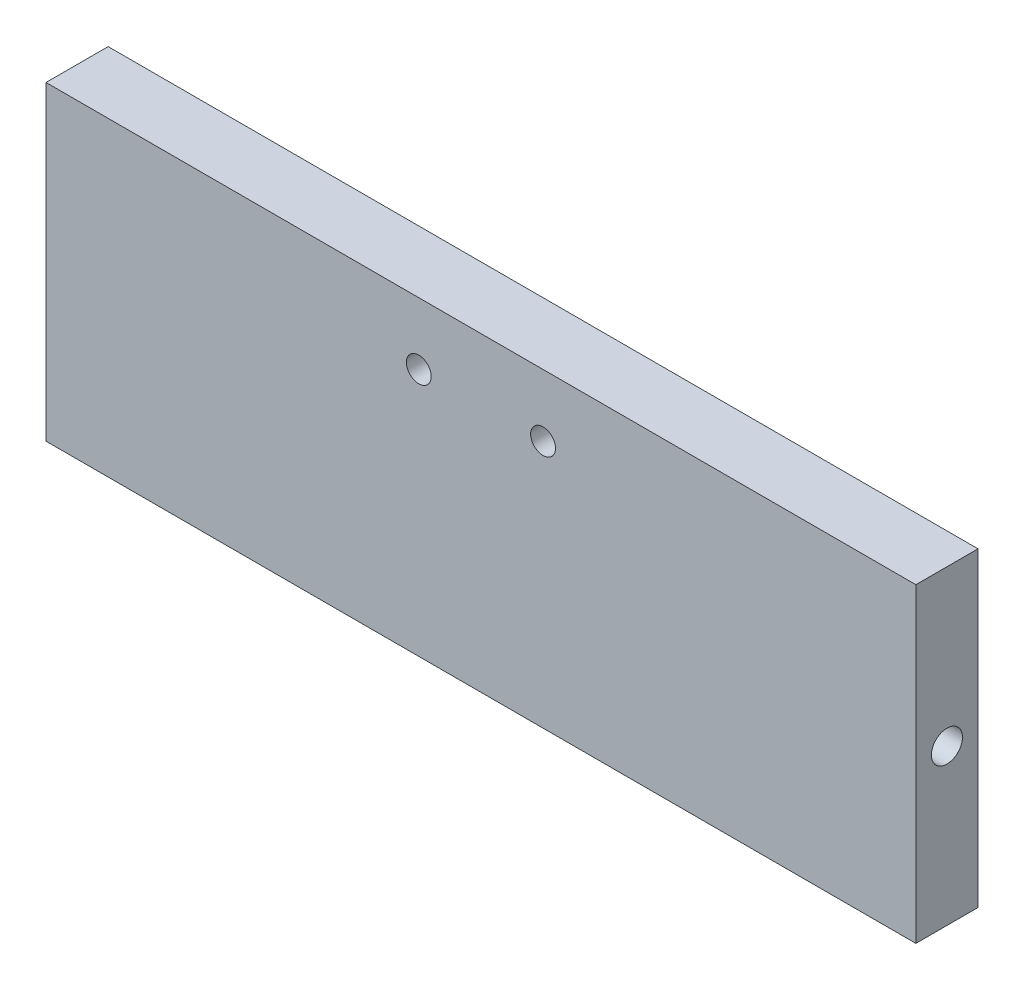
from build123d import *

# Parameters (mm, degrees)
SKETCH1_W           = 140
SKETCH1_H           = 50
SKETCH1_R           = 2
BOSS_EXTRUDE1_DEPTH = 10
SKETCH2_R           = 2.5
CUT_EXTRUDE1_DEPTH  = 153


with BuildPart() as part:
    # Sketch1 → Boss-Extrude1 (new body)
    with BuildSketch(Plane.XY):
        Rectangle(SKETCH1_W, SKETCH1_H)
        with Locations((-10, 15)):
            Circle(SKETCH1_R, mode=Mode.SUBTRACT)
        with Locations(Location((10, 15, 0), (0, 0, 180))):
            Circle(SKETCH1_R, mode=Mode.SUBTRACT)
    extrude(amount=BOSS_EXTRUDE1_DEPTH)

    # Sketch2 → Cut-Extrude1 (cut)
    with BuildSketch(Plane(origin=(70, 0, 0), x_dir=(0, 0, -1), z_dir=(1, 0, 0))):
        with Locations((-5, 0)):
            Circle(SKETCH2_R)
    extrude(amount=-CUT_EXTRUDE1_DEPTH, mode=Mode.SUBTRACT)


solid = part.part
